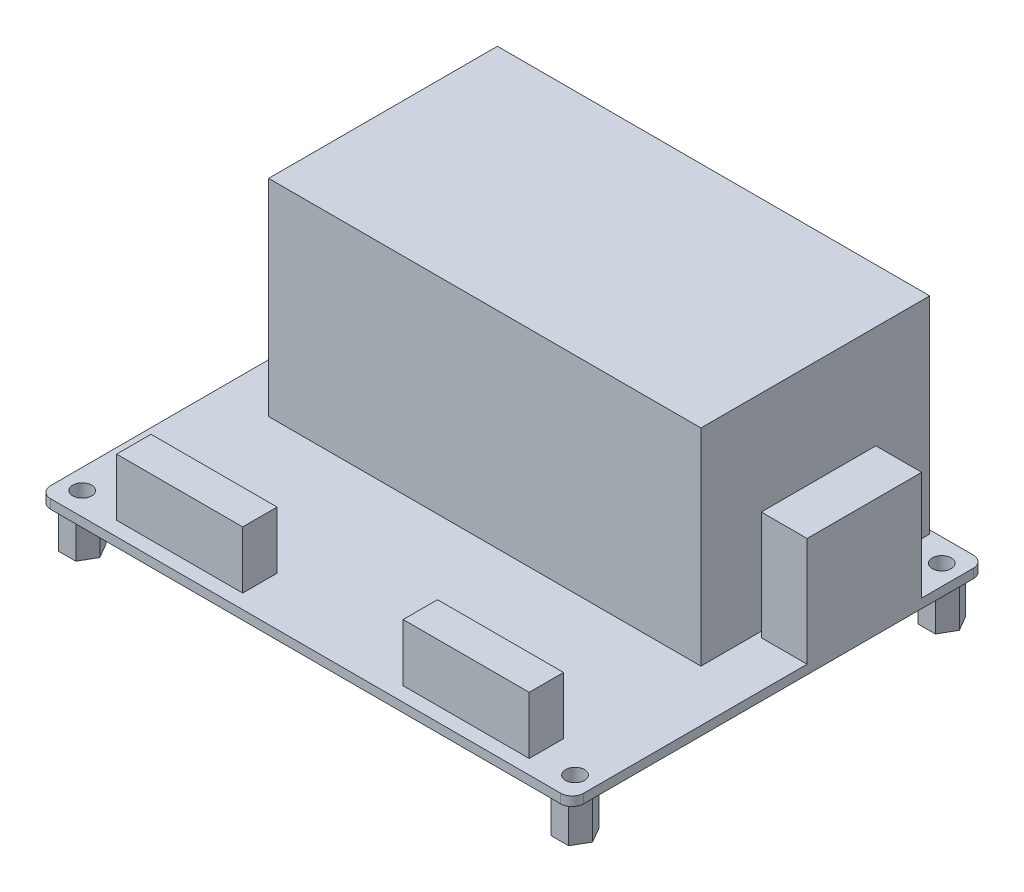
from build123d import *
from build123d.topology import SkipClean

# Parameters (mm, degrees)
SKETCH_1_R      = 1.65
EXTRUDE_1_DEPTH = 1.6
SKETCH_2_W      = 22
SKETCH_2_H      = 6
EXTRUDE_2_DEPTH = 10
SKETCH_3_W      = 75.446569178
SKETCH_3_H      = 39.931008624
EXTRUDE_3_DEPTH = 36
SKETCH_4_W      = 8
SKETCH_4_H      = 20
EXTRUDE_4_DEPTH = 19
EXTRUDE_START   = 7
SKETCH_5_R      = 1.65
EXTRUDE_5_DEPTH = 7


with BuildPart() as part:
    # 草图1 → 凸台-拉伸1 (new body)
    with BuildSketch(Plane(origin=(0, 0, 0), x_dir=(1, 0, 0), z_dir=(0, 1, 0))):
        with BuildLine():
            Line((-44.5, -36), (44.5, -36))
            ThreePointArc((44.5, -36), (45.914213562, -35.414213562), (46.5, -34))
            Line((46.5, -34), (46.5, 34))
            ThreePointArc((46.5, 34), (45.914213562, 35.414213562), (44.5, 36))
            Line((44.5, 36), (-44.5, 36))
            ThreePointArc((-44.5, 36), (-45.914213562, 35.414213562), (-46.5, 34))
            Line((-46.5, 34), (-46.5, -34))
            ThreePointArc((-46.5, -34), (-45.914213562, -35.414213562), (-44.5, -36))
        make_face()
        with Locations(Location((-43, 32, 0), (0, 0, 270))):
            Circle(SKETCH_1_R, mode=Mode.SUBTRACT)
        with Locations(Location((43, 32, 0), (0, 0, 270))):
            Circle(SKETCH_1_R, mode=Mode.SUBTRACT)
        with Locations(Location((43, -32, 0), (0, 0, 270))):
            Circle(SKETCH_1_R, mode=Mode.SUBTRACT)
        with Locations(Location((-43, -32, 0), (0, 0, 270))):
            Circle(SKETCH_1_R, mode=Mode.SUBTRACT)
    extrude(amount=EXTRUDE_1_DEPTH)

    # 草图2 → 凸台-拉伸2 (add)
    with BuildSketch(Plane(origin=(0, 1.6, 0), x_dir=(1, 0, 0), z_dir=(0, 1, 0))):
        with Locations((-24.5, -30.5)):
            Rectangle(SKETCH_2_W, SKETCH_2_H)
        with Locations((25.5, -30.5)):
            Rectangle(SKETCH_2_W, SKETCH_2_H)
    extrude(amount=EXTRUDE_2_DEPTH)

    # 草图3 → 凸台-拉伸3 (add)
    with BuildSketch(Plane(origin=(0, 1.6, 0), x_dir=(1, 0, 0), z_dir=(0, 1, 0))):
        with Locations((-0.191976003, 15.406074241)):
            Rectangle(SKETCH_3_W, SKETCH_3_H)
    extrude(amount=EXTRUDE_3_DEPTH)

    # 草图4 → 凸台-拉伸4 (add)
    with BuildSketch(Plane(origin=(0, 1.6, 0), x_dir=(1, 0, 0), z_dir=(0, 1, 0))):
        with Locations((-42.5, 15)):
            Rectangle(SKETCH_4_W, SKETCH_4_H)
        with Locations((42.5, 15)):
            Rectangle(SKETCH_4_W, SKETCH_4_H)
    extrude(amount=EXTRUDE_4_DEPTH)

    # 草图5 → 凸台-拉伸5 (add)
    # profile 1 of 4: a face of its own
    with SkipClean():  # the faces are left unmerged after this step: merging them gives an invalid solid
        with BuildSketch(Plane.XZ.offset(EXTRUDE_START)):
            Polygon((39.940043573, -32), (41.470021787, -34.65), (44.529978213, -34.65), (46.059956427, -32), (44.529978213, -29.35), (41.470021787, -29.35), align=None)
            with Locations(Location((43, -32, 0), (0, 0, 270))):
                Circle(SKETCH_5_R, mode=Mode.SUBTRACT)
        # profile 2 of 4: a face of its own
        with BuildSketch(Plane.XZ.offset(EXTRUDE_START)):
            Polygon((-39.940043573, -32), (-41.470021787, -29.35), (-44.529978213, -29.35), (-46.059956427, -32), (-44.529978213, -34.65), (-41.470021787, -34.65), align=None)
            with Locations(Location((-43, -32, 0), (0, 0, 270))):
                Circle(SKETCH_5_R, mode=Mode.SUBTRACT)
        # profile 3 of 4: a face of its own
        with BuildSketch(Plane.XZ.offset(EXTRUDE_START)):
            Polygon((-39.940043573, 32), (-41.470021787, 34.65), (-44.529978213, 34.65), (-46.059956427, 32), (-44.529978213, 29.35), (-41.470021787, 29.35), align=None)
            with Locations(Location((-43, 32, 0), (0, 0, 270))):
                Circle(SKETCH_5_R, mode=Mode.SUBTRACT)
        # profile 4 of 4: a face of its own
        with BuildSketch(Plane.XZ.offset(EXTRUDE_START)):
            Polygon((39.940043573, 32), (41.470021787, 29.35), (44.529978213, 29.35), (46.059956427, 32), (44.529978213, 34.65), (41.470021787, 34.65), align=None)
            with Locations(Location((43, 32, 0), (0, 0, 270))):
                Circle(SKETCH_5_R, mode=Mode.SUBTRACT)
        extrude(amount=-EXTRUDE_5_DEPTH)


solid = part.part
